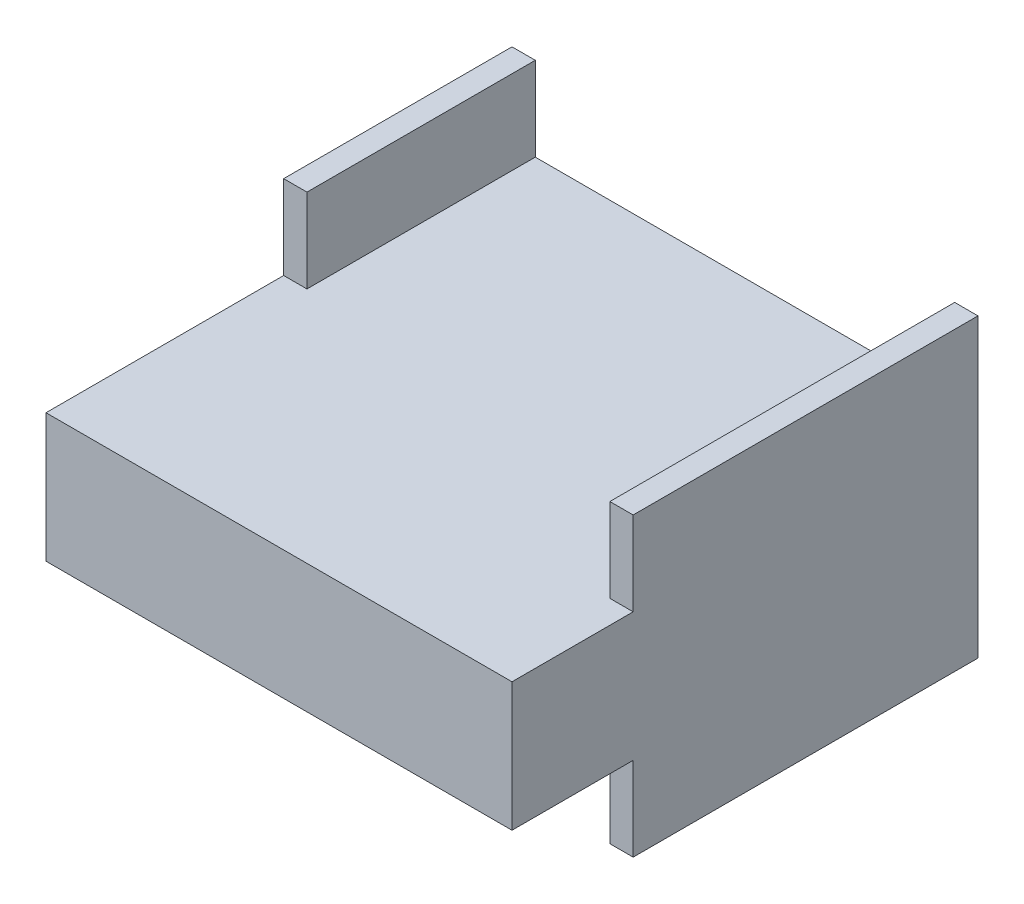
from build123d import *

# Parameters (mm, degrees)
SKETCH1_W           = 50
SKETCH1_H           = 50
BOSS_EXTRUDE1_DEPTH = 15.9
SKETCH2_W           = 45
SKETCH2_H           = 9
CUT_EXTRUDE1_DEPTH  = 59.118929791
SKETCH3_W           = 13
SKETCH3_H           = 9
CUT_EXTRUDE2_DEPTH  = 56.982675892
SKETCH4_W           = 25.5
SKETCH4_H           = 9
CUT_EXTRUDE3_DEPTH  = 56.982675892


with BuildPart() as part:
    # Sketch1 → Boss-Extrude1 (new, symmetric)
    with BuildSketch(Plane(origin=(0, 0, 0), x_dir=(1, 0, 0), z_dir=(0, 1, 0))):
        Rectangle(SKETCH1_W, SKETCH1_H)
    extrude(amount=BOSS_EXTRUDE1_DEPTH, both=True)

    # Sketch2 → Cut-Extrude1 (cut, through all)
    with BuildSketch(Plane.XY.offset(25)):
        with Locations((0, 11.4)):
            Rectangle(SKETCH2_W, SKETCH2_H)
    cut_extrude1 = extrude(amount=-CUT_EXTRUDE1_DEPTH, mode=Mode.SUBTRACT)

    # Sketch3 → Cut-Extrude2 (cut, through all)
    with BuildSketch(Plane.ZY.offset(-22.5)):
        with Locations((18.5, 11.4)):
            Rectangle(SKETCH3_W, SKETCH3_H)
    cut_extrude2 = extrude(amount=-CUT_EXTRUDE2_DEPTH, mode=Mode.SUBTRACT)

    # Sketch4 → Cut-Extrude3 (cut, through all)
    with BuildSketch(Plane(origin=(-22.5, 0, 0), x_dir=(0, 0, -1), z_dir=(1, 0, 0))):
        with Locations((-12.25, 11.4)):
            Rectangle(SKETCH4_W, SKETCH4_H)
    cut_extrude3 = extrude(amount=-CUT_EXTRUDE3_DEPTH, mode=Mode.SUBTRACT)

    # Mirror1: Cut-Extrude1, Cut-Extrude2, Cut-Extrude3 across plane
    add(cut_extrude1.mirror(Plane.ZX), mode=Mode.SUBTRACT)
    add(cut_extrude2.mirror(Plane.ZX), mode=Mode.SUBTRACT)
    add(cut_extrude3.mirror(Plane.ZX), mode=Mode.SUBTRACT)


solid = part.part
